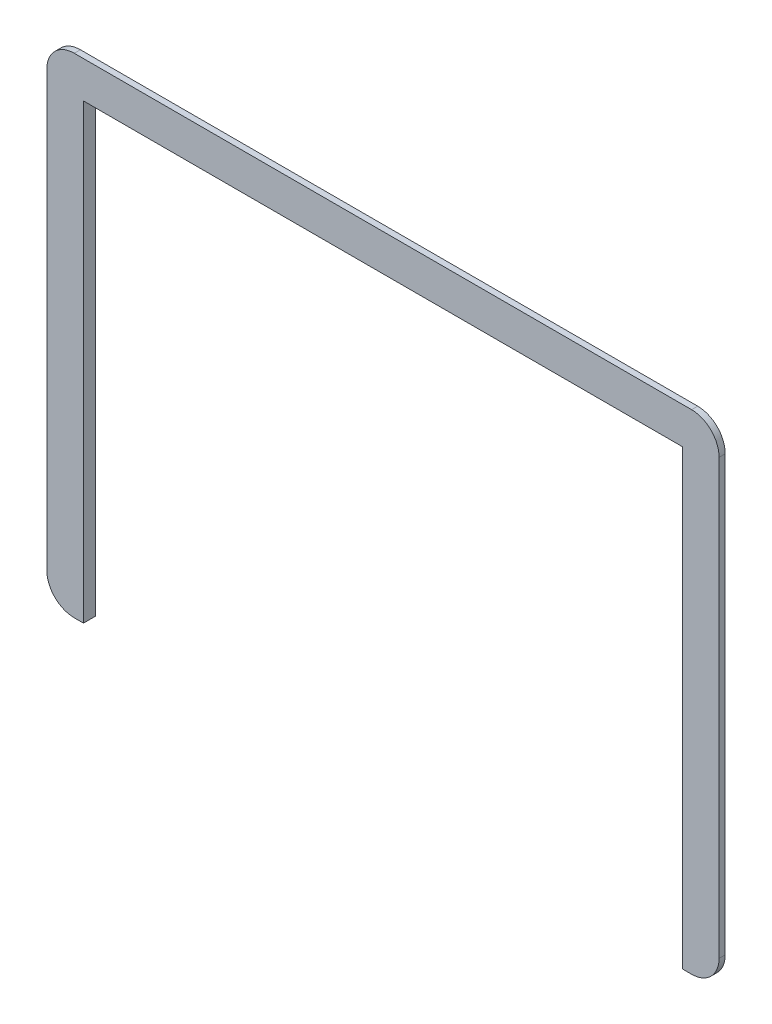
from build123d import *

# Parameters (mm, degrees)
BOSS_EXTRU_1_DEPTH = 2
BOSS_EXTRU_2_START = 2
BOSS_EXTRU_2_DEPTH = 4
CONG_1_R           = 9


with BuildPart() as part:
    # Esquisse1 → Boss.-Extru.1 (new body)
    with BuildSketch(Plane.XY):
        Polygon((-40.70550554, -19.868421053), (-30.70550554, -19.868421053), (-30.70550554, 130.131578947), (169.29449446, 130.131578947), (169.29449446, -19.868421053), (179.29449446, -19.868421053), (179.29449446, 140.131578947), (-40.70550554, 140.131578947), align=None)
    extrude(amount=BOSS_EXTRU_1_DEPTH)

    # Esquisse2 → Boss.-Extru.2 (add)
    with BuildSketch(Plane.XY.offset(BOSS_EXTRU_2_START)):
        Polygon((-30.70550554, -19.868421053), (-28.70550554, -19.868421053), (-28.70550554, 128.131578947), (167.29449446, 128.131578947), (167.29449446, -19.868421053), (169.29449446, -19.868421053), (169.29449446, 130.131578947), (-30.70550554, 130.131578947), align=None)
    extrude(amount=-BOSS_EXTRU_2_DEPTH)

    # Congé1
    cong_1_edges = [part.edges().sort_by_distance(p)[0] for p in [
        (-40.70550554, 140.131578947, 1),
        (179.29449446, 140.131578947, 1),
        (179.29449446, -19.868421053, 1),
        (-40.70550554, -19.868421053, 1),
    ]]
    fillet(cong_1_edges, radius=CONG_1_R)


solid = part.part
